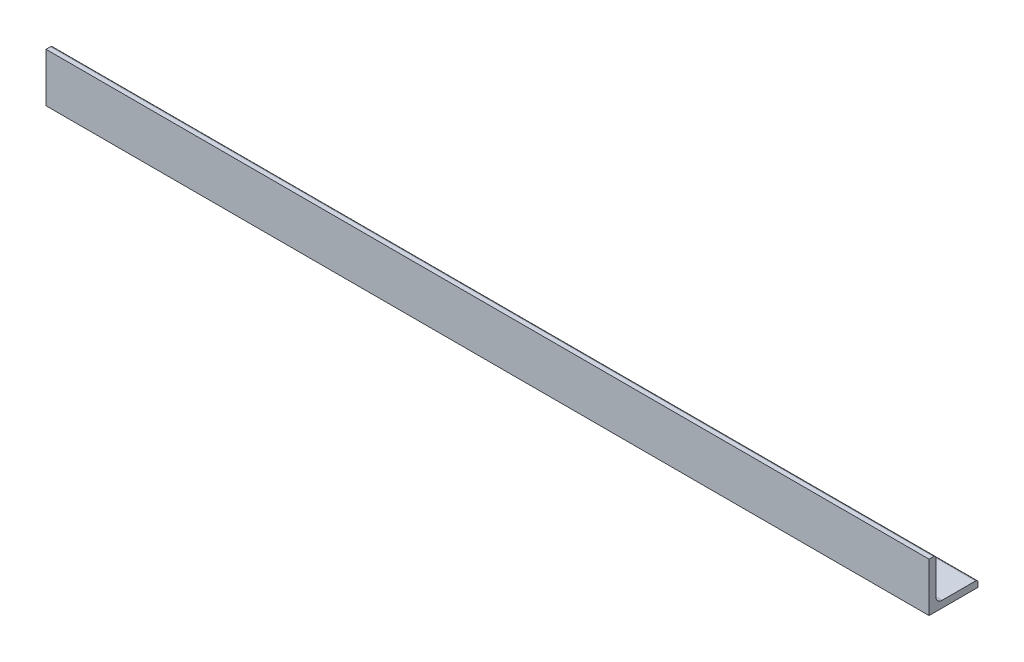
from build123d import *

# Parameters (mm, degrees)
L_ANGLE_EQUAL_3_6X5_1_DEPTH = 650


with BuildPart() as part:
    # Sketch1 → L angle (equal) 3.6X5(1) (new body)
    with BuildSketch(Plane.YZ):
        with BuildLine():
            Line((36, 0), (0, 0))
            Line((0, 0), (0, -36))
            Line((0, -36), (3.333333333, -36))
            ThreePointArc((3.333333333, -36), (4.511844635, -35.511844635), (5, -34.333333333))
            Line((5, -34.333333333), (5, -9.5))
            ThreePointArc((5, -9.5), (6.318019485, -6.318019485), (9.5, -5))
            Line((9.5, -5), (34.333333333, -5))
            ThreePointArc((34.333333333, -5), (35.511844635, -4.511844635), (36, -3.333333333))
            Line((36, -3.333333333), (36, 0))
        make_face()
    extrude(amount=L_ANGLE_EQUAL_3_6X5_1_DEPTH)


solid = part.part
